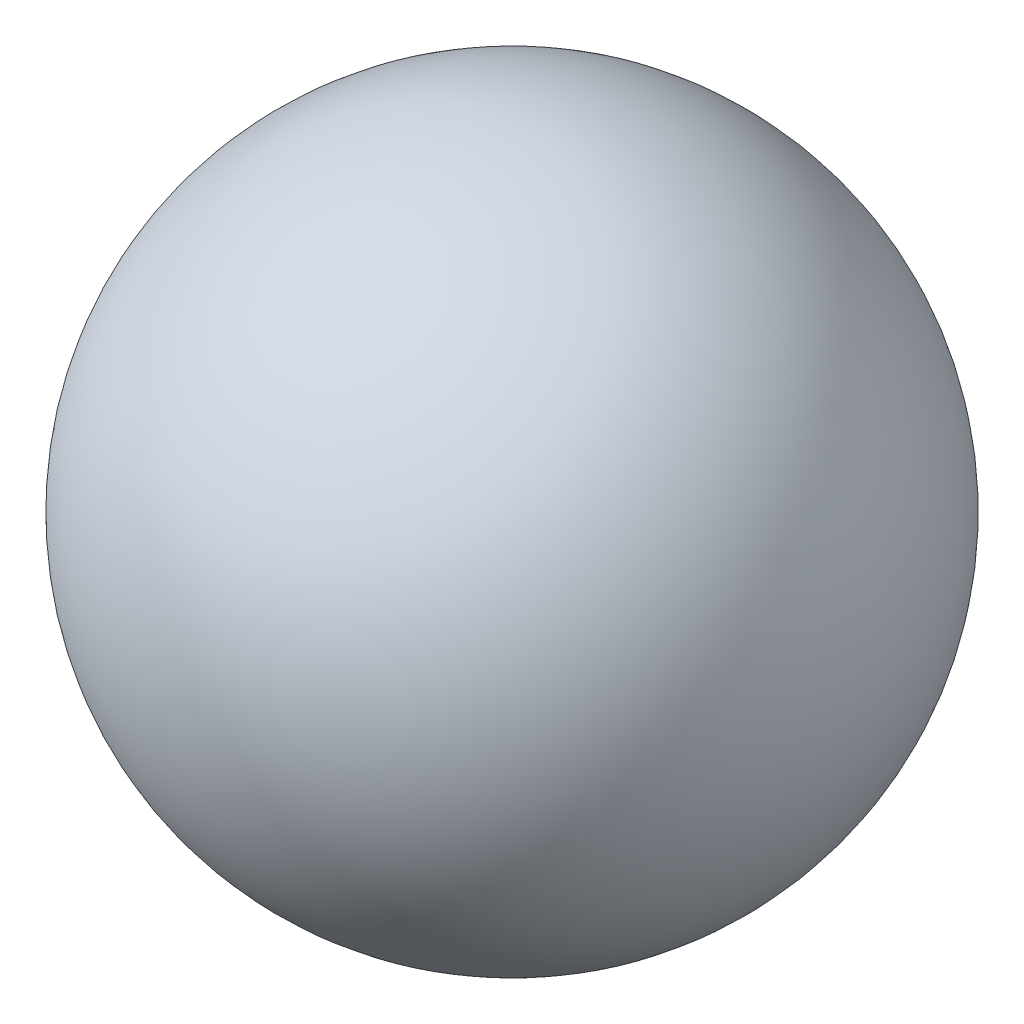
from build123d import *


with BuildPart() as part:
    # 草图1 → 旋转1 (revolve)
    with BuildSketch(Plane.XY):
        with BuildLine():
            Line((0, 2.77), (0, -2.77))
            ThreePointArc((0, -2.77), (2.77, 0), (0, 2.77))
        make_face()
    revolve(axis=Axis((0, 2.77, 0), (0, -1, 0)))


solid = part.part
